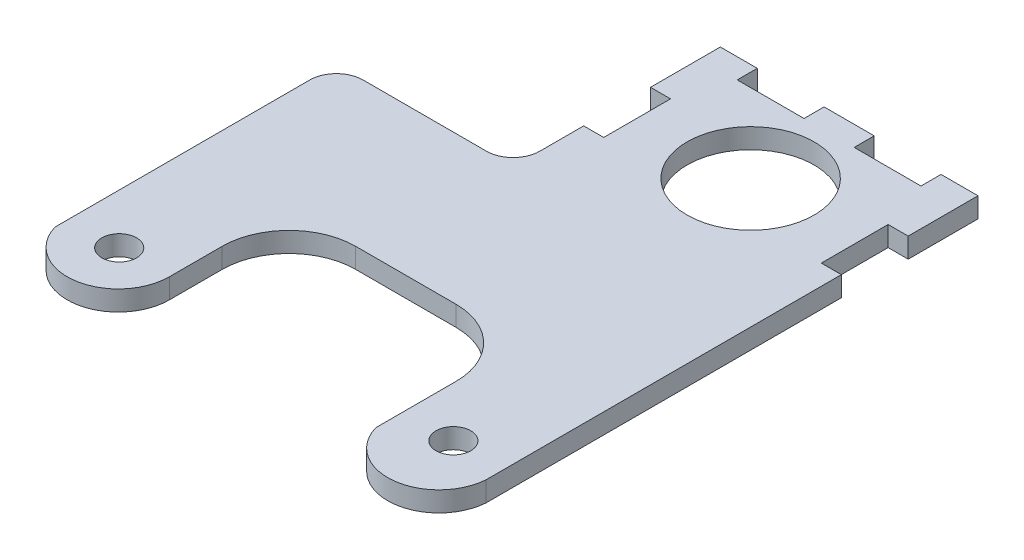
from build123d import *

# Parameters (mm, degrees)
SKETCH1_R           = 2.6
SKETCH1_R_2         = 9.5
BOSS_EXTRUDE1_DEPTH = 3
SKETCH2_W           = 10
SKETCH2_H           = 3
SKETCH2_W_2         = 3
SKETCH2_H_2         = 10
CUT_EXTRUDE1_DEPTH  = 3


with BuildPart() as part:
    # Sketch1 → Boss-Extrude1 (new body)
    with BuildSketch(Plane(origin=(0, 0, 0), x_dir=(1, 0, 0), z_dir=(0, 1, 0))):
        with BuildLine():
            Line((-32.5, -1.331915835), (-32.5, -34.437048929))
            ThreePointArc((-32.5, -34.437048929), (-24.085532921, -39.90046288), (-17.5, -32.331915835))
            Line((-17.5, -32.331915835), (-17.5, -24.442231617))
            ThreePointArc((-17.5, -24.442231617), (-14.571067812, -17.371163805), (-7.5, -14.442231617))
            Line((-7.5, -14.442231617), (7.5, -14.442231617))
            ThreePointArc((7.5, -14.442231617), (14.571067812, -17.371163805), (17.5, -24.442231617))
            Line((17.5, -24.442231617), (17.5, -32.331915835))
            Line((17.5, -32.331915835), (17.5, -36.417098288))
            ThreePointArc((17.5, -36.417098288), (25.631797985, -41.985078136), (32.5, -34.917098288))
            Line((32.5, -34.917098288), (32.5, -33.831915835))
            Line((32.5, -33.831915835), (32.5, -1.331915835))
            Line((32.5, -1.331915835), (32.5, 3.668084165))
            Line((32.5, 3.668084165), (32.5, 38.668084165))
            Line((32.5, 38.668084165), (32.441371292, 38.668084165))
            Line((32.441371292, 38.668084165), (-6.058628708, 38.668084165))
            Line((-6.058628708, 38.668084165), (-6.058628708, 14.168084165))
            Line((-6.058628708, 14.168084165), (-6.058628708, 11.668084165))
            ThreePointArc((-6.058628708, 11.668084165), (-7.230201584, 8.83965704), (-10.058628708, 7.668084165))
            Line((-10.058628708, 7.668084165), (-28.5, 7.668084165))
            ThreePointArc((-28.5, 7.668084165), (-31.328427125, 6.49651129), (-32.5, 3.668084165))
            Line((-32.5, 3.668084165), (-32.5, 3.101498414))
            Line((-32.5, 3.101498414), (-32.5, -1.331915835))
        make_face()
        with Locations(Location((-25, -32.331915835, 0), (0, 0, 270))):
            Circle(SKETCH1_R, mode=Mode.SUBTRACT)
        with Locations(Location((25, -32.331915835, 0), (0, 0, 270))):
            Circle(SKETCH1_R, mode=Mode.SUBTRACT)
        with Locations(Location((13.245823136, 23.897996209, 0), (0, 0, 270))):
            Circle(SKETCH1_R_2, mode=Mode.SUBTRACT)
    extrude(amount=BOSS_EXTRUDE1_DEPTH)

    # Sketch2 → Cut-Extrude1 (cut)
    with BuildSketch(Plane(origin=(0, 3, 0), x_dir=(1, 0, 0), z_dir=(0, 1, 0))):
        with Locations((4.470685646, 37.168084165)):
            Rectangle(SKETCH2_W, SKETCH2_H)
        with Locations((-4.558628708, 23.22062572)):
            Rectangle(SKETCH2_W_2, SKETCH2_H_2)
        with Locations((21.970685646, 37.168084165)):
            Rectangle(SKETCH2_W, SKETCH2_H)
        with Locations((31, 23.22062572)):
            Rectangle(SKETCH2_W_2, SKETCH2_H_2)
    extrude(amount=-CUT_EXTRUDE1_DEPTH, mode=Mode.SUBTRACT)


solid = part.part
